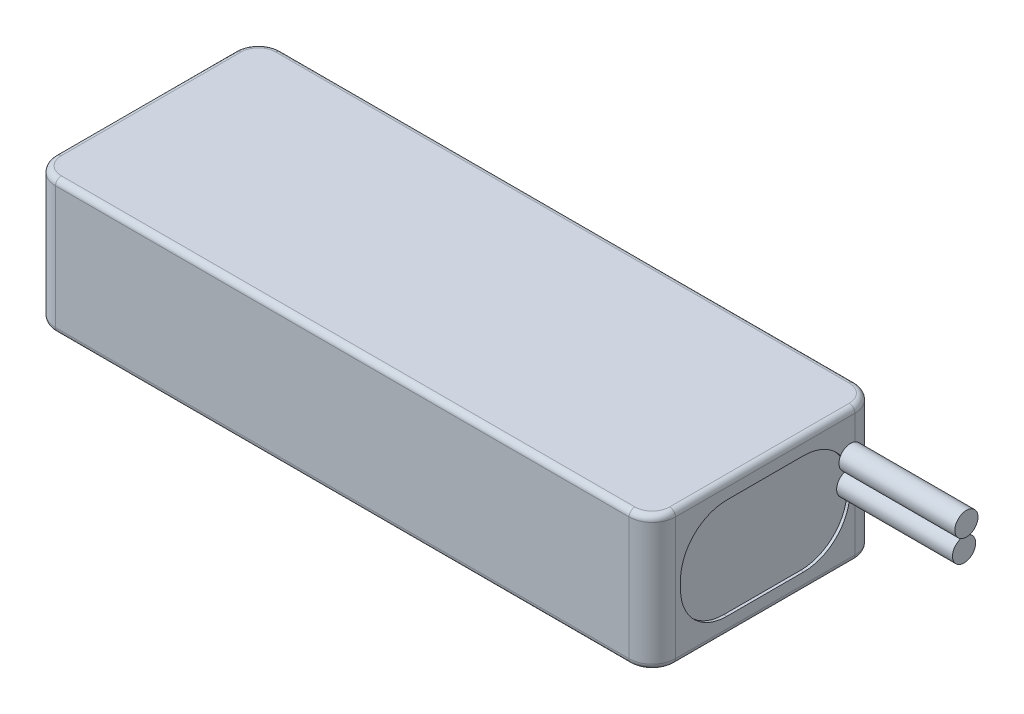
from build123d import *

# Parameters (mm, degrees)
SKETCH1_W           = 107
SKETCH1_H           = 23.18
BOSS_EXTRUDE1_DEPTH = 39
CUT_EXTRUDE1_DEPTH  = 0.5
CUT_EXTRUDE2_START  = -0.5
CUT_EXTRUDE2_DEPTH  = 0.5
FILLET1_R           = 4
FILLET2_R           = 1
SKETCH5_R           = 2
BOSS_EXTRUDE2_DEPTH = 20
SKETCH7_R           = 2
BOSS_EXTRUDE3_DEPTH = 20


with BuildPart() as part:
    # Sketch1 → Boss-Extrude1 (new body)
    with BuildSketch(Plane(origin=(0, 0, -15), x_dir=(-1, 0, 0), z_dir=(0, 0, -1))):
        with Locations((-15.5, -10.41)):
            Rectangle(SKETCH1_W, SKETCH1_H)
    extrude(amount=-BOSS_EXTRUDE1_DEPTH)

    # Sketch2 → Cut-Extrude1 (cut)
    with BuildSketch(Plane(origin=(69, 0, 0), x_dir=(0, 0, -1), z_dir=(1, 0, 0))):
        with BuildLine():
            Line((-19.125, -9.7175), (-19.125, -11.1025))
            ThreePointArc((-19.125, -11.1025), (-16.781854249, -16.759354249), (-11.125, -19.1025))
            Line((-11.125, -19.1025), (2.125, -19.1025))
            ThreePointArc((2.125, -19.1025), (7.781854249, -16.759354249), (10.125, -11.1025))
            Line((10.125, -11.1025), (10.125, -9.7175))
            ThreePointArc((10.125, -9.7175), (7.781854249, -4.060645751), (2.125, -1.7175))
            Line((2.125, -1.7175), (-11.125, -1.7175))
            ThreePointArc((-11.125, -1.7175), (-16.781854249, -4.060645751), (-19.125, -9.7175))
        make_face()
    extrude(amount=-CUT_EXTRUDE1_DEPTH, mode=Mode.SUBTRACT)

    # Sketch3 → Cut-Extrude2 (cut)
    with BuildSketch(Plane.ZY.offset(38).offset(CUT_EXTRUDE2_START)):
        with BuildLine():
            Line((11.125, -1.7175), (-2.125, -1.7175))
            ThreePointArc((-2.125, -1.7175), (-7.781854249, -4.060645751), (-10.125, -9.7175))
            Line((-10.125, -9.7175), (-10.125, -11.1025))
            ThreePointArc((-10.125, -11.1025), (-7.781854249, -16.759354249), (-2.125, -19.1025))
            Line((-2.125, -19.1025), (11.125, -19.1025))
            ThreePointArc((11.125, -19.1025), (16.781854249, -16.759354249), (19.125, -11.1025))
            Line((19.125, -11.1025), (19.125, -9.7175))
            ThreePointArc((19.125, -9.7175), (16.781854249, -4.060645751), (11.125, -1.7175))
        make_face()
    extrude(amount=CUT_EXTRUDE2_DEPTH, mode=Mode.SUBTRACT)

    # Fillet1
    fillet1_edges = [part.edges().sort_by_distance(p)[0] for p in [
        (-38, -10.41, 24),
        (69, -10.41, 24),
        (-38, -10.41, -15),
        (69, -10.41, -15),
    ]]
    fillet(fillet1_edges, radius=FILLET1_R)

    # Fillet2
    fillet2_edges = [part.edges().sort_by_distance(p)[0] for p in [
        (15.5, -22, -15),
        (15.5, 1.18, -15),
        (-38, 1.18, 4.5),
        (15.5, 1.18, 24),
        (69, 1.18, 4.5),
        (67.828427125, 1.18, 22.828427125),
        (67.828427125, 1.18, -13.828427125),
        (-36.828427125, 1.18, 22.828427125),
        (-36.828427125, 1.18, -13.828427125),
        (-38, -22, 4.5),
        (69, -22, 4.5),
        (15.5, -22, 24),
        (67.828427125, -22, 22.828427125),
        (67.828427125, -22, -13.828427125),
        (-36.828427125, -22, 22.828427125),
        (-36.828427125, -22, -13.828427125),
    ]]
    fillet(fillet2_edges, radius=FILLET2_R)

    # Sketch5 → Boss-Extrude2 (add)
    with BuildSketch(Plane(origin=(69, 0, 0), x_dir=(0, 0, -1), z_dir=(1, 0, 0))):
        with Locations(Location((10.227970674, -5.937982546, 0), (0, 0, 148.897384026))):
            Circle(SKETCH5_R)
    extrude(amount=BOSS_EXTRUDE2_DEPTH)

    # Sketch7 → Boss-Extrude3 (add)
    with BuildSketch(Plane(origin=(68.5, 0, 0), x_dir=(0, 0, -1), z_dir=(1, 0, 0))):
        with Locations(Location((10.325411399, -10.113287546, 0), (0, 0, 100.265525012))):
            Circle(SKETCH7_R)
    extrude(amount=BOSS_EXTRUDE3_DEPTH)


solid = part.part
